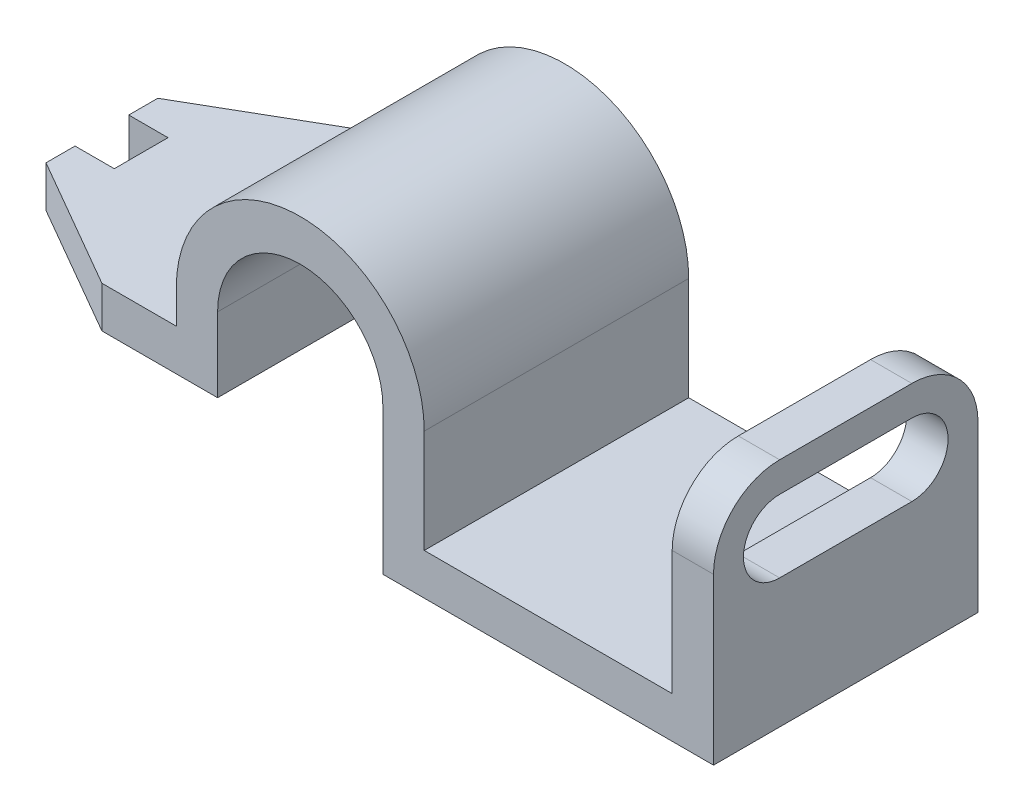
from build123d import *

# Parameters (mm, degrees)
SALIENTE_EXTRUIR1_DEPTH = 32
CORTAR_EXTRUIR1_REACH   = 113.66
CROQUIS2_W              = 9.5
CROQUIS2_H              = 13
CORTAR_EXTRUIR2_REACH   = 196.034
REDONDEO2_R             = 16


with BuildPart() as part:
    # Croquis1 → Saliente-Extruir1 (new, symmetric)
    with BuildSketch(Plane.XY):
        with BuildLine():
            Line((-100, 27), (-100, 17))
            Line((-100, 17), (-40, 17))
            Line((-40, 17), (-40, 35))
            ThreePointArc((-40, 35), (-20, 55), (0, 35))
            Line((0, 35), (0, 0))
            Line((0, 0), (80, 0))
            Line((80, 0), (80, 56))
            Line((80, 56), (70, 56))
            Line((70, 56), (70, 10))
            Line((70, 10), (10, 10))
            Line((10, 10), (10, 35))
            ThreePointArc((10, 35), (-20, 65), (-50, 35))
            Line((-50, 35), (-50, 27))
            Line((-50, 27), (-100, 27))
        make_face()
    extrude(amount=SALIENTE_EXTRUIR1_DEPTH, both=True)

    # Croquis2 → Cortar-Extruir1 (cut, up to next)
    with BuildSketch(Plane(origin=(0, 27, 0), x_dir=(1, 0, 0), z_dir=(0, 1, 0)), mode=Mode.PRIVATE) as cortar_extruir1_sk1:
        Polygon((-100, 13.524791386), (-68, 32), (-100, 32), align=None)
    cortar_extruir1_tool1 = extrude(cortar_extruir1_sk1.sketch, amount=-CORTAR_EXTRUIR1_REACH, mode=Mode.PRIVATE) & part.part
    # Croquis2 → Cortar-Extruir1 (cut, up to next)
    with BuildSketch(Plane(origin=(0, 27, 0), x_dir=(1, 0, 0), z_dir=(0, 1, 0)), mode=Mode.PRIVATE) as cortar_extruir1_sk2:
        with Locations((-95.25, 0)):
            Rectangle(CROQUIS2_W, CROQUIS2_H)
    cortar_extruir1_tool2 = extrude(cortar_extruir1_sk2.sketch, amount=-CORTAR_EXTRUIR1_REACH, mode=Mode.PRIVATE) & part.part
    # Croquis2 → Cortar-Extruir1 (cut, up to next)
    with BuildSketch(Plane(origin=(0, 27, 0), x_dir=(1, 0, 0), z_dir=(0, 1, 0)), mode=Mode.PRIVATE) as cortar_extruir1_sk3:
        Polygon((-100, -13.524791386), (-100, -32), (-68, -32), align=None)
    cortar_extruir1_tool3 = extrude(cortar_extruir1_sk3.sketch, amount=-CORTAR_EXTRUIR1_REACH, mode=Mode.PRIVATE) & part.part
    add(cortar_extruir1_tool1.solids().sort_by_distance((-89.333333, 27, -25.841597))[0], mode=Mode.SUBTRACT)
    add(cortar_extruir1_tool2.solids().sort_by_distance((-95.25, 27, 0))[0], mode=Mode.SUBTRACT)
    add(cortar_extruir1_tool3.solids().sort_by_distance((-89.333333, 27, 25.841597))[0], mode=Mode.SUBTRACT)

    # Croquis4 → Cortar-Extruir2 (cut, up to next)
    with BuildSketch(Plane(origin=(80, 0, 0), x_dir=(0, 0, -1), z_dir=(1, 0, 0)), mode=Mode.PRIVATE) as cortar_extruir2_sk1:
        with BuildLine():
            Line((-16, 48.75), (16, 48.75))
            ThreePointArc((16, 48.75), (24.75, 40), (16, 31.25))
            Line((16, 31.25), (-16, 31.25))
            ThreePointArc((-16, 31.25), (-24.75, 40), (-16, 48.75))
        make_face()
    cortar_extruir2_tool1 = extrude(cortar_extruir2_sk1.sketch, amount=-CORTAR_EXTRUIR2_REACH, mode=Mode.PRIVATE) & part.part
    add(cortar_extruir2_tool1.solids().sort_by_distance((80, 40, 0))[0], mode=Mode.SUBTRACT)

    # Redondeo2
    redondeo2_edges = [part.edges().sort_by_distance(p)[0] for p in [
        (75, 56, -32),
        (75, 56, 32),
    ]]
    fillet(redondeo2_edges, radius=REDONDEO2_R)


solid = part.part
